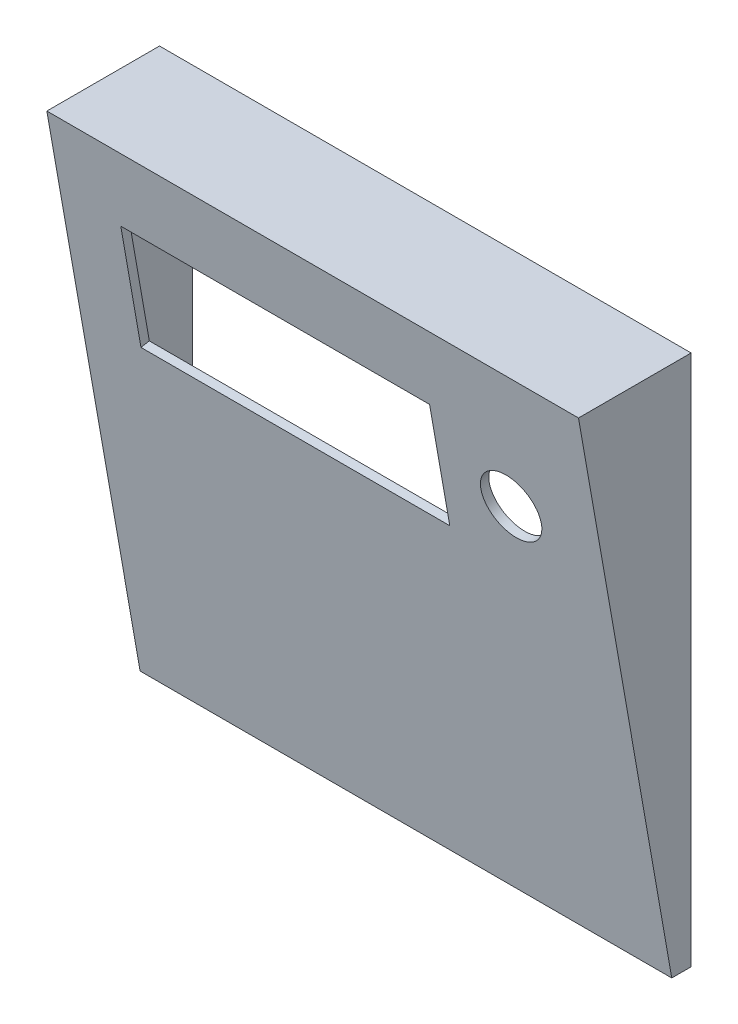
from build123d import *

# Parameters (mm, degrees)
SKETCH1_W           = 87.8
SKETCH1_H           = 87.8
BOSS_EXTRUDE1_DEPTH = 20
SKETCH2_W           = 87.8
SKETCH2_H           = 87.8
SKETCH2_W_2         = 84.5
SKETCH2_H_2         = 84.5
CUT_EXTRUDE1_DEPTH  = 1.4
CUT_EXTRUDE2_DEPTH  = 126.768358501
CUT_EXTRUDE3_REACH  = 127.768
SKETCH4_W           = 79.7
SKETCH4_H           = 79.7
SKETCH5_R           = 5
SKETCH5_W           = 51
SKETCH5_H           = 19.304
CUT_EXTRUDE4_DEPTH  = 126.686719868


with BuildPart() as part:
    # Sketch1 → Boss-Extrude1 (new body)
    with BuildSketch(Plane.XY):
        with Locations((43.9, 43.9)):
            Rectangle(SKETCH1_W, SKETCH1_H)
    extrude(amount=BOSS_EXTRUDE1_DEPTH)

    # Sketch2 → Cut-Extrude1 (cut)
    with BuildSketch(Plane(origin=(0, 0, 0), x_dir=(-1, 0, 0), z_dir=(0, 0, -1))):
        with Locations((-43.9, 43.9)):
            Rectangle(SKETCH2_W, SKETCH2_H)
        with Locations((-43.9, 43.9)):
            Rectangle(SKETCH2_W_2, SKETCH2_H_2, mode=Mode.SUBTRACT)
    extrude(amount=-CUT_EXTRUDE1_DEPTH, mode=Mode.SUBTRACT)

    # Sketch3 → Cut-Extrude2 (cut, through all)
    with BuildSketch(Plane(origin=(87.8, 0, 0), x_dir=(0, 0, -1), z_dir=(1, 0, 0))):
        Polygon((-20, 87.8), (-4.6, 0), (-20, 0), align=None)
    extrude(amount=-CUT_EXTRUDE2_DEPTH, mode=Mode.SUBTRACT)

    # Cut-Extrude3: up to this plane
    cut_extrude3_end = Plane(origin=(0, 88.041865807, 18.621050787), z_dir=(0, 0.17276129088861056, -0.9849637233779227))
    # Sketch4 → Cut-Extrude3 (cut, up to the surface)
    with BuildSketch(Plane(origin=(0, 0, 0), x_dir=(-1, 0, 0), z_dir=(0, 0, -1)), mode=Mode.PRIVATE) as cut_extrude3_sk1:
        with Locations((-43.9, 43.9)):
            Rectangle(SKETCH4_W, SKETCH4_H)
    cut_extrude3_tool1 = split(extrude(cut_extrude3_sk1.sketch, amount=-CUT_EXTRUDE3_REACH, mode=Mode.PRIVATE), bisect_by=cut_extrude3_end, keep=Keep.BOTH, mode=Mode.PRIVATE)
    add(cut_extrude3_tool1.solids().sort_by_distance((43.9, 43.9, 0))[0], mode=Mode.SUBTRACT)

    # Sketch5 → Cut-Extrude4 (cut, through all)
    with BuildSketch(Plane(origin=(0, -0.78275258, 4.462706267), x_dir=(1, 0, 0), z_dir=(0, -0.1727612908886106, 0.9849637233779227))):
        with Locations(Location((72.8, 67.524905437, 0), (0, 0, 270))):
            Circle(SKETCH5_R)
        with Locations((35.5, 67.524905437)):
            Rectangle(SKETCH5_W, SKETCH5_H)
    extrude(amount=-CUT_EXTRUDE4_DEPTH, mode=Mode.SUBTRACT)


solid = part.part
